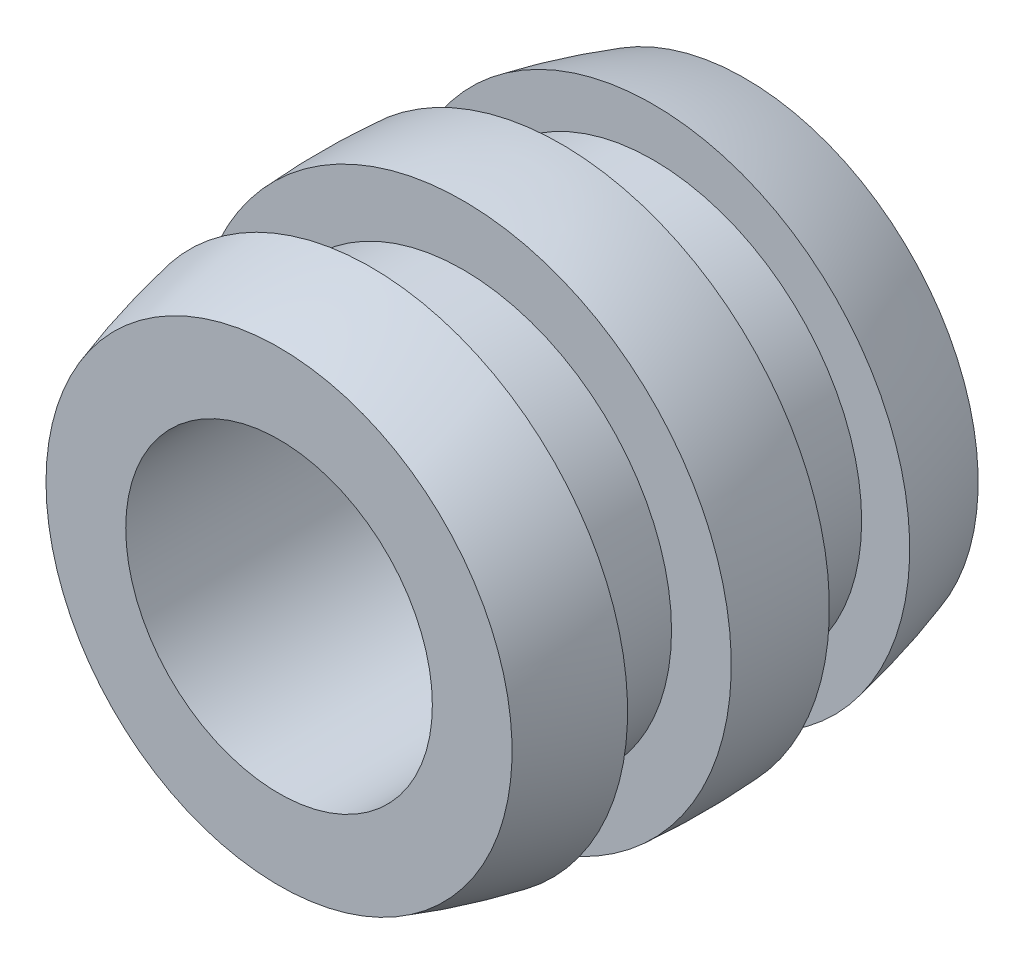
from build123d import *

# Parameters (mm, degrees)
CUT_EXTRUDE1_DEPTH      = 24.149212362
CUT_EXTRUDE1_DEPTH_BACK = 24.149212362
SKETCH3_R               = 7.9375


with BuildPart() as part:
    # Sketch2 → Revolve1 (revolve)
    with BuildSketch(Plane(origin=(0, 0, 0), x_dir=(0, 0, -1), z_dir=(1, 0, 0)), mode=Mode.PRIVATE) as revolve1_sk:
        with BuildLine():
            Line((12.065, 0), (-12.065, 0))
            Line((-12.065, 0), (-12.065, 12.065))
            ThreePointArc((-12.065, 12.065), (-9.702882831, 12.74884018), (-7.3025, 13.283065955))
            Line((-7.3025, 13.283065955), (-7.3025, 10.795))
            Line((-7.3025, 10.795), (-2.54, 10.795))
            Line((-2.54, 10.795), (-2.54, 13.887534788))
            ThreePointArc((-2.54, 13.887534788), (0, 13.97), (2.54, 13.887534788))
            Line((2.54, 13.887534788), (2.54, 10.795))
            Line((2.54, 10.795), (7.3025, 10.795))
            Line((7.3025, 10.795), (7.3025, 13.283065955))
            ThreePointArc((7.3025, 13.283065955), (9.702882831, 12.74884018), (12.065, 12.065))
            Line((12.065, 12.065), (12.065, 0))
        make_face()
    revolve(revolve1_sk.sketch.rotate(Axis((0, 0, -12.065), (0, 0, 1)), 90), axis=Axis((0, 0, -12.065), (0, 0, 1)))

    # Sketch3 → Cut-Extrude1 (cut, two sides: drawn at the far end of the back side and taken through both)
    with BuildSketch(Plane.XY.offset(-CUT_EXTRUDE1_DEPTH_BACK)):
        Circle(SKETCH3_R)
    extrude(amount=CUT_EXTRUDE1_DEPTH + CUT_EXTRUDE1_DEPTH_BACK, mode=Mode.SUBTRACT)


solid = part.part
